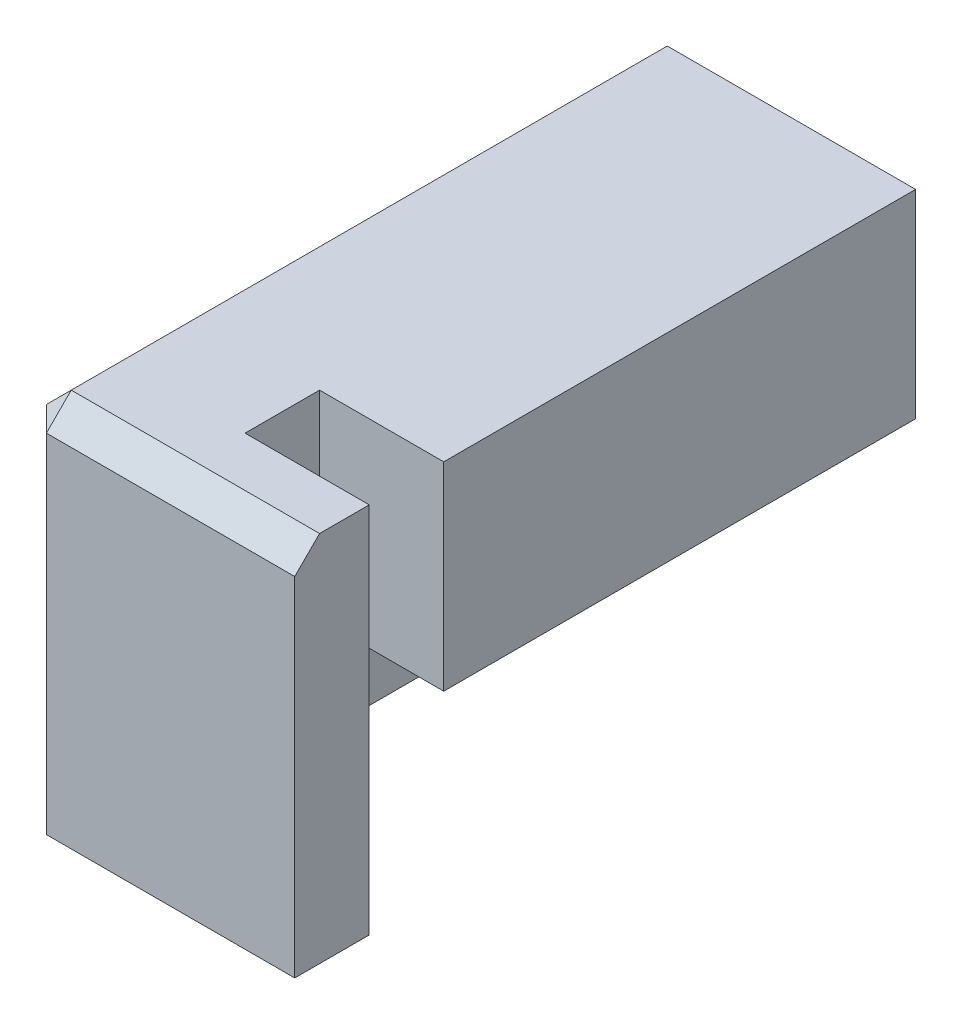
from build123d import *

# Parameters (mm, degrees)
BOSS_EXTRUDE1_DEPTH = 15
SKETCH2_W           = 3
SKETCH2_H           = 41.822305452
CUT_EXTRUDE1_DEPTH  = 12
CHAMFER1_SIZE       = 1
SKETCH3_W           = 5.696125243
SKETCH3_H           = 11.031228464
CUT_EXTRUDE2_DEPTH  = 22


with BuildPart() as part:
    # Sketch1 → Boss-Extrude1 (new body)
    with BuildSketch(Plane(origin=(0, 0, 0), x_dir=(1, 0, 0), z_dir=(0, 1, 0))):
        Polygon((0, 0), (5, 0), (5, 19), (-6, 19), (-6, -6), (5, -6), (5, -3), (0, -3), align=None)
    extrude(amount=BOSS_EXTRUDE1_DEPTH)

    # Sketch2 → Cut-Extrude1 (cut)
    with BuildSketch(Plane.XZ):
        with Locations((-1.5, -17.911152726)):
            Rectangle(SKETCH2_W, SKETCH2_H)
    extrude(amount=-CUT_EXTRUDE1_DEPTH, mode=Mode.SUBTRACT)

    # Chamfer1
    chamfer1_edges = [part.edges().sort_by_distance(p)[0] for p in [
        (-6, 7.5, 6),
        (-6, 15, -6.5),
        (-0.5, 15, 6),
    ]]
    chamfer(chamfer1_edges, length=CHAMFER1_SIZE)

    # Sketch3 → Cut-Extrude2 (cut)
    with BuildSketch(Plane(origin=(0, 0, -19), x_dir=(-1, 0, 0), z_dir=(0, 0, -1))):
        with Locations((-2.848062622, 1.484385768)):
            Rectangle(SKETCH3_W, SKETCH3_H)
    extrude(amount=-CUT_EXTRUDE2_DEPTH, mode=Mode.SUBTRACT)


solid = part.part
